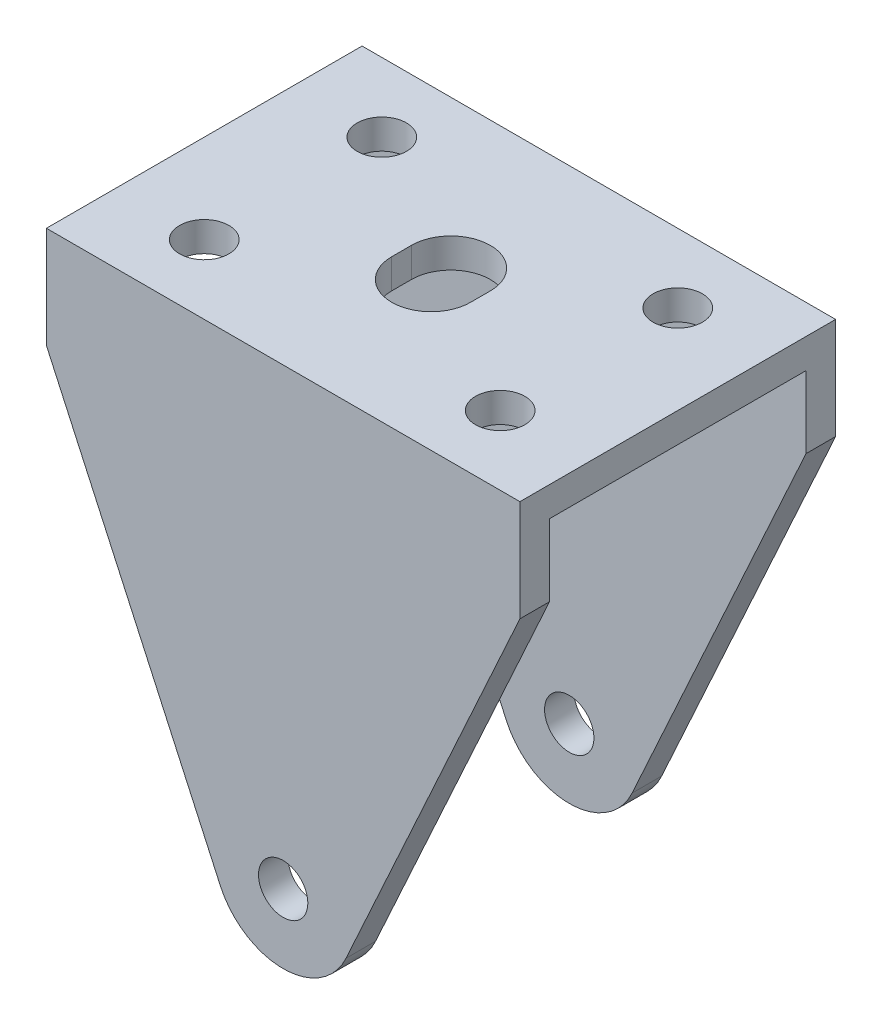
from build123d import *

# Parameters (mm, degrees)
SKETCH1_W                = 48
SKETCH1_H                = 32
BOSS_EXTRUDE1_DEPTH      = 3
SKETCH2_W                = 48
SKETCH2_H                = 3
BOSS_EXTRUDE2_DEPTH      = 50
CUT_EXTRUDE1_DEPTH       = 67.400301204
CUT_EXTRUDE1_DEPTH_BACK  = 67.400301204
SKETCH3_R                = 2.5
F_5_0_5_DIAMETER_HOLE1_D = 5
KES_EKSTR_ZYON1_DEPTH    = 7


with BuildPart() as part:
    # Sketch1 → Boss-Extrude1 (new body)
    with BuildSketch(Plane(origin=(0, 0, 0), x_dir=(1, 0, 0), z_dir=(0, 1, 0))):
        Rectangle(SKETCH1_W, SKETCH1_H)
    extrude(amount=-BOSS_EXTRUDE1_DEPTH)

    # Sketch2 → Boss-Extrude2 (add)
    with BuildSketch(Plane.XZ.offset(3)):
        with Locations((0, 14.5)):
            Rectangle(SKETCH2_W, SKETCH2_H)
        with Locations((0, -14.5)):
            Rectangle(SKETCH2_W, SKETCH2_H)
    extrude(amount=BOSS_EXTRUDE2_DEPTH)

    # Sketch3 → Cut-Extrude1 (cut, two sides: drawn at the far end of the back side and taken through both)
    with BuildSketch(Plane.XY.offset(16).offset(-CUT_EXTRUDE1_DEPTH_BACK)):
        with BuildLine():
            Line((24, -53), (24, -10.287171893))
            Line((24, -10.287171893), (6.367730582, -48.907233604))
            ThreePointArc((6.367730582, -48.907233604), (3.784796178, -51.8885752), (-8.6e-08, -53))
            Line((-8.6e-08, -53), (24, -53))
        make_face()
        with BuildLine():
            Line((-24, -53), (-8.6e-08, -53))
            ThreePointArc((-8.6e-08, -53), (-3.784796251, -51.888575154), (-6.367730582, -48.907233604))
            Line((-6.367730582, -48.907233604), (-24, -10.287171893))
            Line((-24, -10.287171893), (-24, -53))
        make_face()
        with Locations((0, -46)):
            Circle(SKETCH3_R)
    extrude(amount=CUT_EXTRUDE1_DEPTH + CUT_EXTRUDE1_DEPTH_BACK, mode=Mode.SUBTRACT)

    # Ø5.0 (5) Diameter Hole1 (through all)
    with Locations(Plane(origin=(0, 0, 0), x_dir=(1, 0, 0), z_dir=(0, 1, 0))):
        with Locations((-15, -9), (-15, 9), (15, 9), (15, -9)):
            Hole(F_5_0_5_DIAMETER_HOLE1_D / 2)

    # Çizim1 → Kes-Ekstrüzyon1 (cut)
    with BuildSketch(Plane(origin=(0, 0, 0), x_dir=(1, 0, 0), z_dir=(0, 1, 0))):
        with BuildLine():
            Line((-4, 1), (-4, -1))
            ThreePointArc((-4, -1), (0, -5), (4, -1))
            Line((4, -1), (4, 1))
            ThreePointArc((4, 1), (0, 5), (-4, 1))
        make_face()
    extrude(amount=-KES_EKSTR_ZYON1_DEPTH, mode=Mode.SUBTRACT)


solid = part.part
